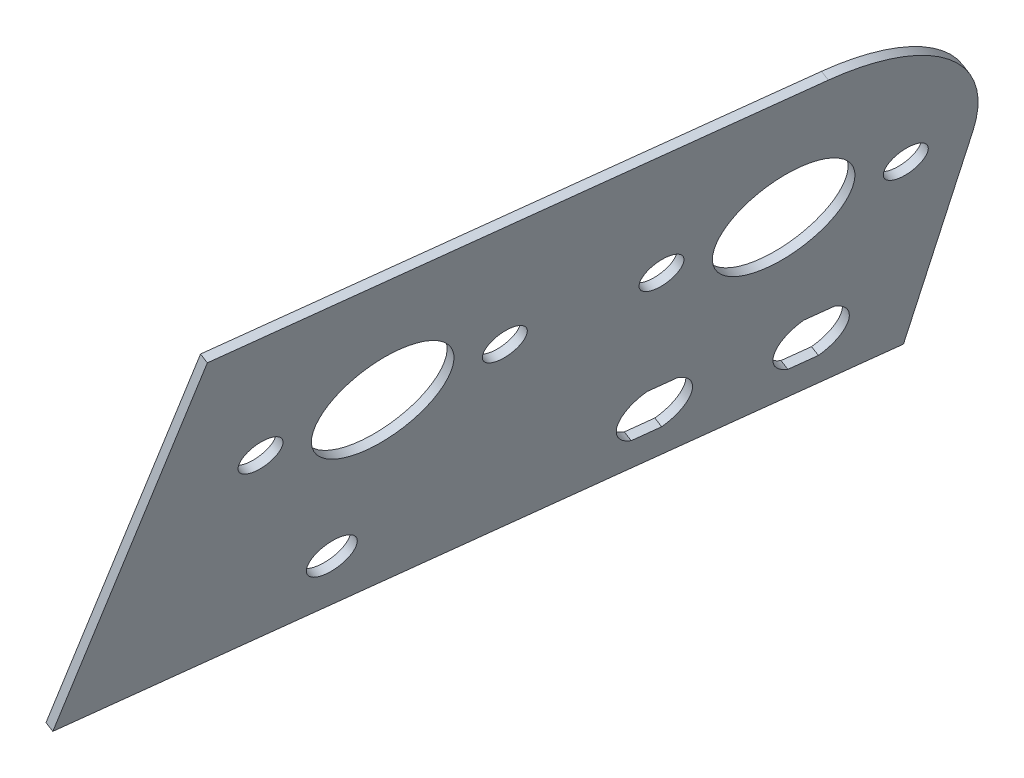
from build123d import *

# Parameters (mm, degrees)
SKETCH39_R          = 11.25
SKETCH39_R_2        = 3.55
SKETCH39_R_3        = 4.024999951
BOSS_EXTRUDE1_DEPTH = 1.5875


with BuildPart() as part:
    # Sketch39 → Boss-Extrude1 (new body)
    with BuildSketch(Plane(origin=(-441.521969452, 172.104793819, -62.182961286), x_dir=(-0.12122181659134341, 0.04725213510134498, 0.9915001295565519), z_dir=(-0.9237984742451071, 0.3600956621414251, -0.1301056996804562))):
        with BuildLine():
            Line((-227.779978176, 213.473332746), (-90.363815922, 201.963804234))
            Line((-90.363815922, 201.963804234), (-90.363815922, 280.537968932))
            Line((-90.363815922, 280.537968932), (-190.676741831, 288.939851665))
            ThreePointArc((-190.676741831, 288.939851665), (-213.041445426, 281.797087727), (-223.80498218, 260.932157339))
            Line((-223.80498218, 260.932157339), (-227.779978176, 213.473332746))
        make_face()
        with Locations((-128.463815922, 252.946692942)):
            Circle(SKETCH39_R, mode=Mode.SUBTRACT)
        with Locations((-108.73290302, 251.294096181)):
            Circle(SKETCH39_R_2, mode=Mode.SUBTRACT)
        with Locations((-148.194728824, 254.599289703)):
            Circle(SKETCH39_R_2, mode=Mode.SUBTRACT)
        with Locations((-193.237014843, 258.371884328)):
            Circle(SKETCH39_R, mode=Mode.SUBTRACT)
        with Locations((-173.506101941, 256.719287567)):
            Circle(SKETCH39_R_2, mode=Mode.SUBTRACT)
        with Locations((-212.967927745, 260.024481088)):
            Circle(SKETCH39_R_2, mode=Mode.SUBTRACT)
        with Locations((-131.378812986, 218.143554906)):
            Circle(SKETCH39_R_3, mode=Mode.SUBTRACT)
        with BuildLine():
            Line((-210.812041783, 230.315880525), (-205.885245836, 229.903228203))
            ThreePointArc((-205.885245836, 229.903228203), (-202.798738622, 224.125454392), (-206.803355147, 218.941609924))
            Line((-206.803355147, 218.941609924), (-211.730151094, 219.354262246))
            ThreePointArc((-211.730151094, 219.354262246), (-214.816658309, 225.132036057), (-210.812041783, 230.315880525))
        make_face(mode=Mode.SUBTRACT)
        with BuildLine():
            Line((-185.500668667, 228.195882655), (-180.57387272, 227.783230333))
            ThreePointArc((-180.57387272, 227.783230333), (-177.48736551, 222.005456528), (-181.49198203, 216.821612065))
            Line((-181.49198203, 216.821612065), (-186.418777977, 217.234264387))
            ThreePointArc((-186.418777977, 217.234264387), (-189.505285187, 223.012038192), (-185.500668667, 228.195882655))
        make_face(mode=Mode.SUBTRACT)
    extrude(amount=BOSS_EXTRUDE1_DEPTH)


solid = part.part
